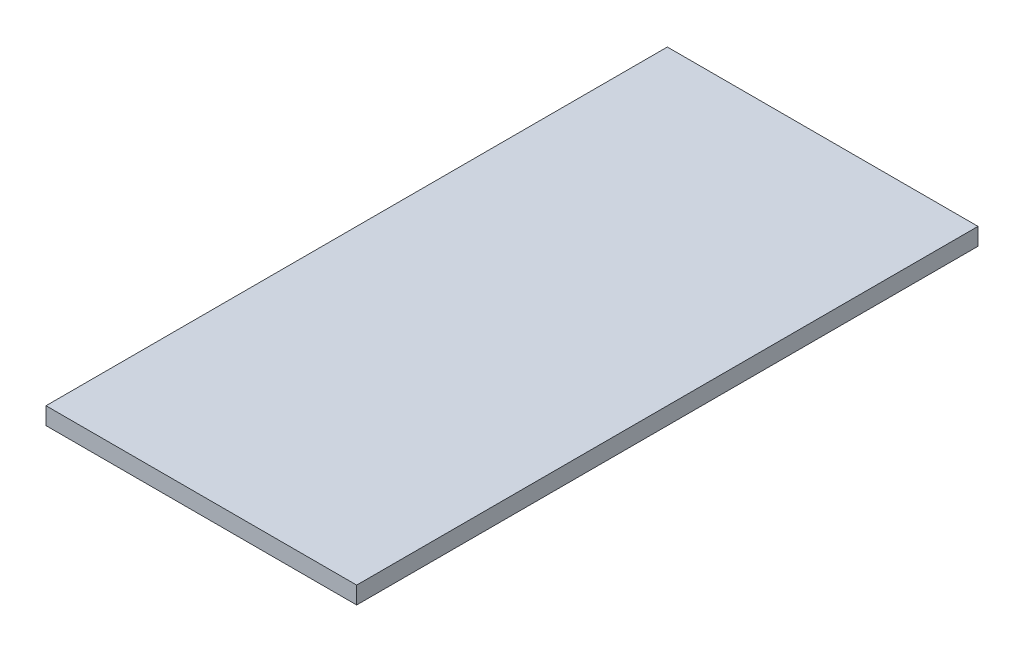
from build123d import *

# Parameters (mm, degrees)
ESQUISSE1_W        = 54
ESQUISSE1_H        = 108
BOSS_EXTRU_1_DEPTH = 3


with BuildPart() as part:
    # Esquisse1 → Boss.-Extru.1 (new body)
    with BuildSketch(Plane(origin=(0, 0, 0), x_dir=(1, 0, 0), z_dir=(0, 1, 0))):
        Rectangle(ESQUISSE1_W, ESQUISSE1_H)
    extrude(amount=BOSS_EXTRU_1_DEPTH)


solid = part.part
